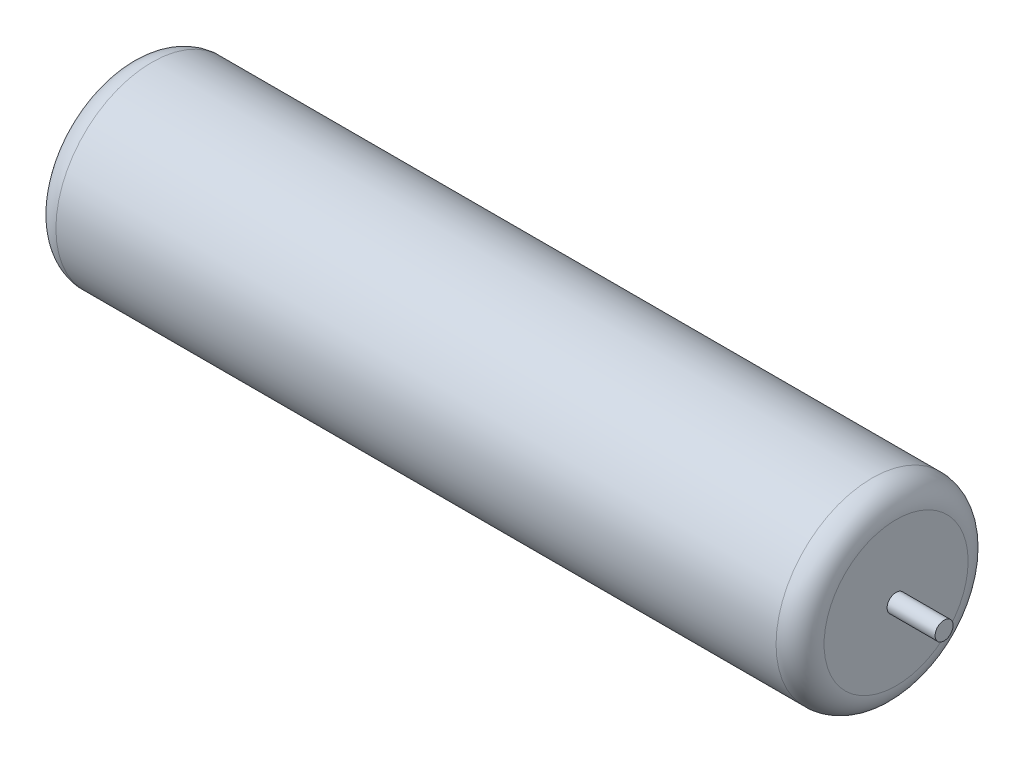
from build123d import *

# Parameters (mm, degrees)
SKETCH_3_R           = 4
EXTRUDE_1_DEPTH      = 32
FILLET_1_R           = 1
EXTRUDE_2_DEPTH      = 1
EXTRUDE_2_DEPTH_BACK = 34
SKETCH_4_R           = 0.375


with BuildPart() as part:
    # 草图3 → 凸台-拉伸1 (new body)
    with BuildSketch(Plane(origin=(0, 0, 0), x_dir=(0, 0, -1), z_dir=(1, 0, 0))):
        Circle(SKETCH_3_R)
    extrude(amount=EXTRUDE_1_DEPTH)

    # 圆角1
    fillet_1_edges = [part.edges().sort_by_distance(p)[0] for p in [
        (0, 0, 4),
        (32, 0, 4),
    ]]
    fillet(fillet_1_edges, radius=FILLET_1_R)

    # 草图4 → 凸台-拉伸2 (add, two sides: drawn at the far end of the back side and taken through both)
    with BuildSketch(Plane.ZY.offset(-EXTRUDE_2_DEPTH_BACK)):
        Circle(SKETCH_4_R)
    extrude(amount=EXTRUDE_2_DEPTH + EXTRUDE_2_DEPTH_BACK)


solid = part.part
